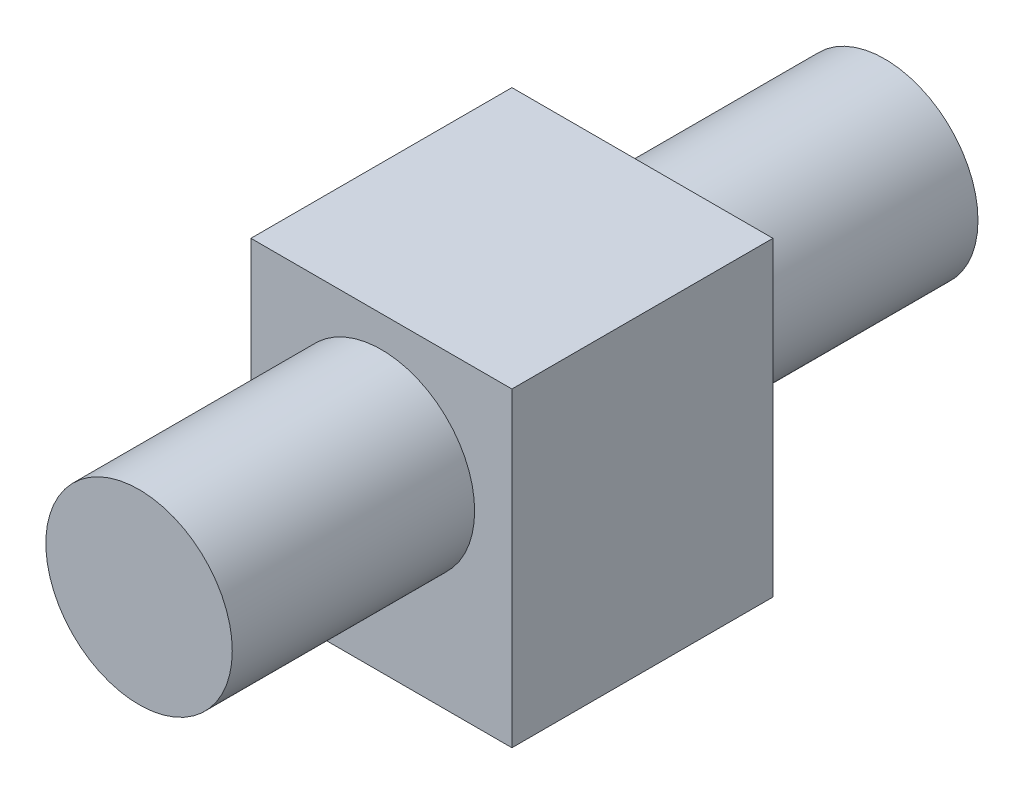
from build123d import *

# Parameters (mm, degrees)
SKETCH1_W                = 42
SKETCH1_H                = 42
BOSS_EXTRUDE1_DEPTH      = 50
BOSS_EXTRUDE2_DEPTH      = 60
BOSS_EXTRUDE2_DEPTH_BACK = 60
SKETCH2_R                = 15


with BuildPart() as part:
    # Sketch1 → Boss-Extrude1 (new body)
    with BuildSketch(Plane(origin=(0, 0, 0), x_dir=(1, 0, 0), z_dir=(0, 1, 0))):
        Rectangle(SKETCH1_W, SKETCH1_H)
    extrude(amount=BOSS_EXTRUDE1_DEPTH)

    # Sketch2 → Boss-Extrude2 (add, two sides: drawn at the far end of the back side and taken through both)
    with BuildSketch(Plane.XY.offset(-BOSS_EXTRUDE2_DEPTH_BACK)):
        with Locations((0, 30)):
            Circle(SKETCH2_R)
    extrude(amount=BOSS_EXTRUDE2_DEPTH + BOSS_EXTRUDE2_DEPTH_BACK)


solid = part.part
